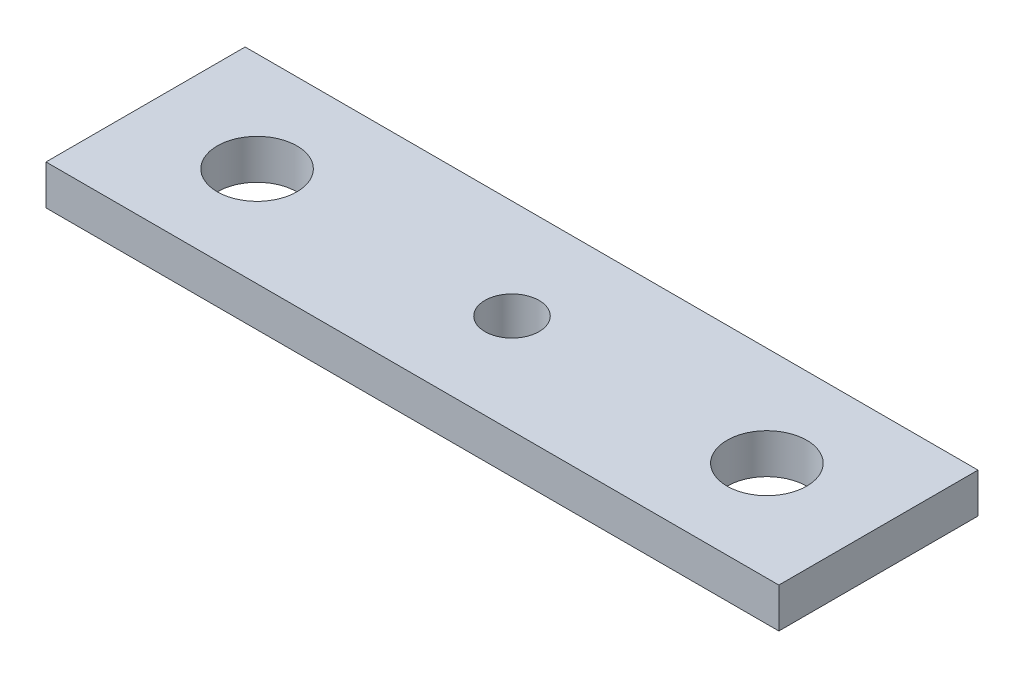
from build123d import *

# Parameters (mm, degrees)
SKETCH_1_W          = 92
SKETCH_1_H          = 25
EXTRUDE_1_DEPTH     = 2.5
SKETCH_2_R          = 5
CUT_EXTRUDE_1_DEPTH = 48.929635926
HOLE_WIZARD_M8_1_D  = 6.8


with BuildPart() as part:
    # 草图1 → 凸台-拉伸1 (new, symmetric)
    with BuildSketch(Plane(origin=(0, 0, 0), x_dir=(1, 0, 0), z_dir=(0, 1, 0))):
        Rectangle(SKETCH_1_W, SKETCH_1_H)
    extrude(amount=EXTRUDE_1_DEPTH, both=True)

    # 草图2 → 切除-拉伸1 (cut, through all)
    with BuildSketch(Plane(origin=(0, 2.5, 0), x_dir=(1, 0, 0), z_dir=(0, 1, 0))):
        with Locations(Location((32, 0, 0), (0, 0, 270))):
            Circle(SKETCH_2_R)
        with Locations(Location((-32, 0, 0), (0, 0, 270))):
            Circle(SKETCH_2_R)
    extrude(amount=-CUT_EXTRUDE_1_DEPTH, mode=Mode.SUBTRACT)

    # M8 螺纹孔1 (through all)
    with Locations(Plane(origin=(0, 2.5, 0), x_dir=(1, 0, 0), z_dir=(0, 1, 0))):
        with Locations((0, 0)):
            Hole(HOLE_WIZARD_M8_1_D / 2)


solid = part.part
